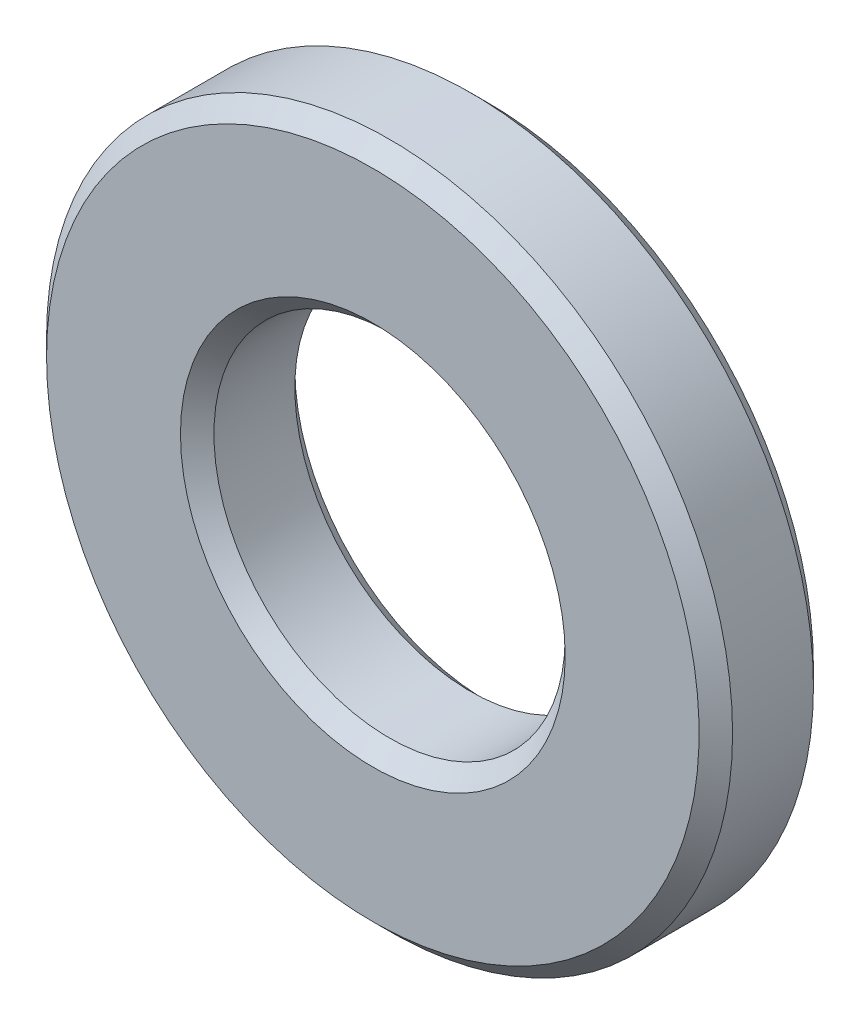
from build123d import *

# Parameters (mm, degrees)
BOSS_EXTRUDE1_DEPTH      = 0.79375
BOSS_EXTRUDE1_DEPTH_BACK = 0.79375
SKETCH3_R                = 4.7625
SKETCH3_R_2              = 2.4384
CHAMFER1_SIZE            = 0.23241


with BuildPart() as part:
    # Sketch3 → Boss-Extrude1 (new, two sides: drawn at the far end of the back side and taken through both)
    with BuildSketch(Plane.XY.offset(-BOSS_EXTRUDE1_DEPTH_BACK)):
        Circle(SKETCH3_R)
        Circle(SKETCH3_R_2, mode=Mode.SUBTRACT)
    extrude(amount=BOSS_EXTRUDE1_DEPTH + BOSS_EXTRUDE1_DEPTH_BACK)

    # Chamfer1
    chamfer1_edges = [part.edges().sort_by_distance(p)[0] for p in [
        (-4.7625, 0, -0.79375),
        (-2.4384, 0, -0.79375),
        (-4.7625, 0, 0.79375),
        (-2.4384, 0, 0.79375),
    ]]
    chamfer(chamfer1_edges, length=CHAMFER1_SIZE)


solid = part.part
